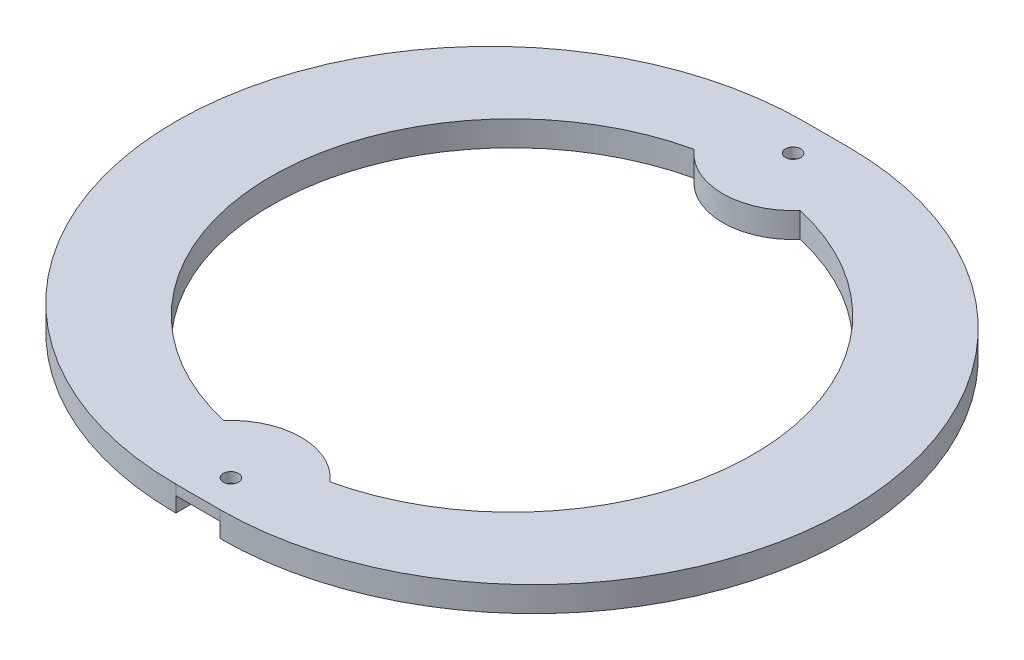
from build123d import *

# Parameters (mm, degrees)
SKETCH89_R          = 0.76
BOSS_EXTRUDE1_DEPTH = 2.5
SKETCH91_W          = 4.4
SKETCH91_H          = 7.5
CUT_EXTRUDE1_DEPTH  = 1.5


with BuildPart() as part:
    # Sketch89 → Boss-Extrude1 (new body)
    with BuildSketch(Plane(origin=(0, 33.039348741, 0), x_dir=(1, 0, 0), z_dir=(0, 1, 0))):
        with BuildLine():
            Line((-2.2, 31.284010223), (2.2, 31.284010223))
            ThreePointArc((2.2, 31.284010223), (33.484010223, 0), (2.2, -31.284010223))
            Line((2.2, -31.284010223), (-2.2, -31.284010223))
            ThreePointArc((-2.2, -31.284010223), (-33.484010223, 0), (-2.2, 31.284010223))
        make_face()
        with Locations(Location((0, 28, 0), (0, 0, 270))):
            Circle(SKETCH89_R, mode=Mode.SUBTRACT)
        with Locations(Location((0, -28, 0), (0, 0, 270))):
            Circle(SKETCH89_R, mode=Mode.SUBTRACT)
        with BuildLine():
            ThreePointArc((-5.285684122, 23.410714286), (0, 21), (5.285684122, 23.410714286))
            ThreePointArc((5.285684122, 23.410714286), (24, 0), (5.285684122, -23.410714286))
            ThreePointArc((5.285684122, -23.410714286), (0, -21), (-5.285684122, -23.410714286))
            ThreePointArc((-5.285684122, -23.410714286), (-24, 0), (-5.285684122, 23.410714286))
        make_face(mode=Mode.SUBTRACT)
    extrude(amount=BOSS_EXTRUDE1_DEPTH)

    # Sketch91 → Cut-Extrude1 (cut)
    with BuildSketch(Plane.XZ.offset(-33.039348741)):
        with Locations((0, 27.534010223)):
            Rectangle(SKETCH91_W, SKETCH91_H)
        with Locations((0, -27.534010223)):
            Rectangle(SKETCH91_W, SKETCH91_H)
    extrude(amount=-CUT_EXTRUDE1_DEPTH, mode=Mode.SUBTRACT)


solid = part.part
